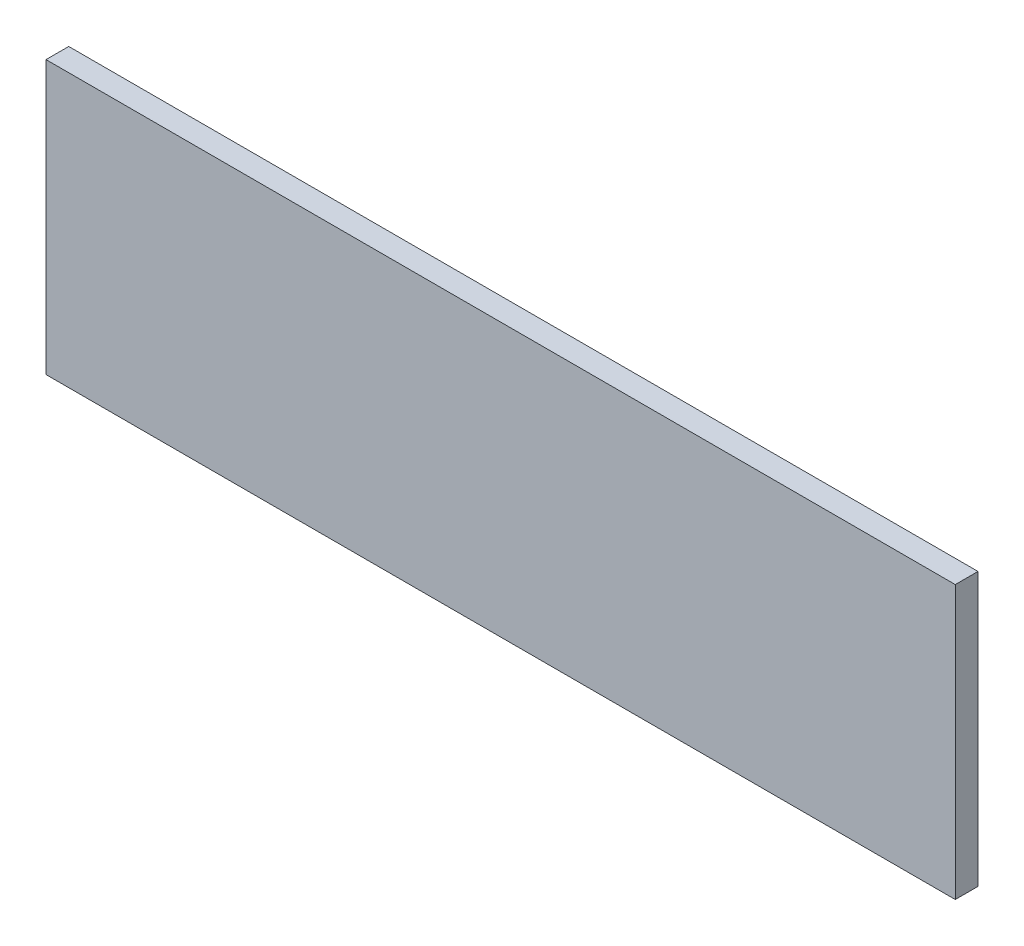
from build123d import *

# Parameters (mm, degrees)
SKETCH1_W           = 254
SKETCH1_H           = 76.2
BOSS_EXTRUDE1_DEPTH = 6.35


with BuildPart() as part:
    # Sketch1 → Boss-Extrude1 (new body)
    with BuildSketch(Plane.XY):
        with Locations((127, 38.1)):
            Rectangle(SKETCH1_W, SKETCH1_H)
    extrude(amount=BOSS_EXTRUDE1_DEPTH)


solid = part.part
